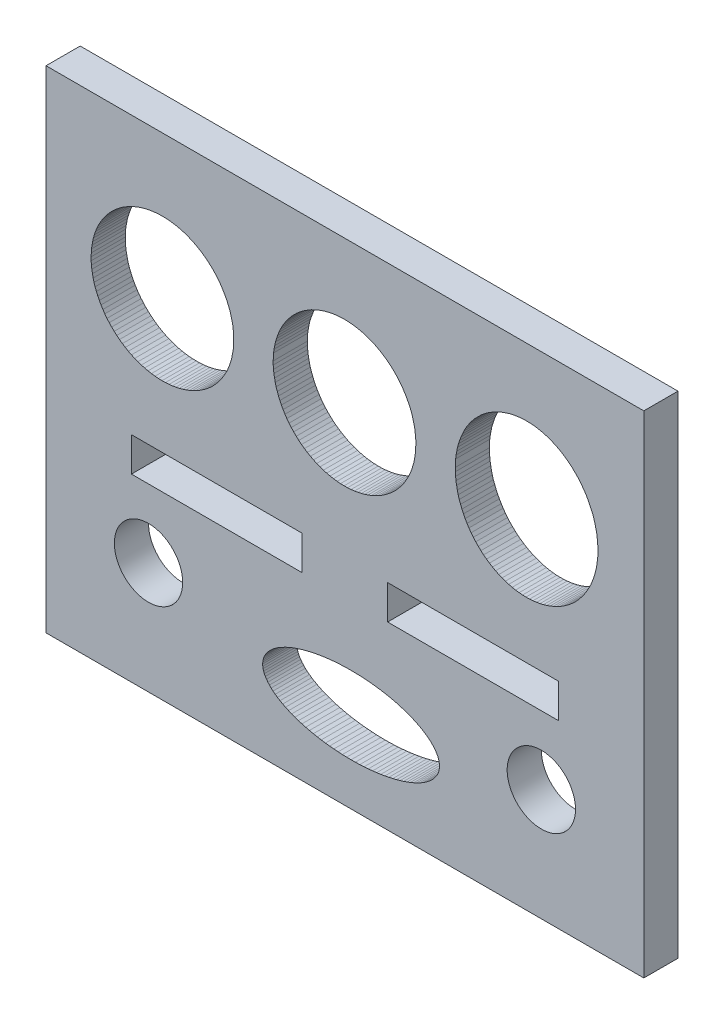
from build123d import *

# Parameters (mm, degrees)
MODEL_R         = 2
MODEL_W         = 10
MODEL_H         = 2
EXTRUDE_1_DEPTH = 2


with BuildPart() as part:
    # Model → 凸台-拉伸1 (new body)
    with BuildSketch(Plane.XY):
        Polygon((794.75972153, 604.491636772), (759.75972153, 604.491600122), (759.75972153, 633.249317629), (794.75972153, 633.249317629), align=None)
        with Locations((765.75972153, 611.043454307)):
            Circle(MODEL_R, mode=Mode.SUBTRACT)
        with Locations((788.75972153, 611.043454307)):
            Circle(MODEL_R, mode=Mode.SUBTRACT)
        with Locations((784.759690917, 616.042625672)):
            Rectangle(MODEL_W, MODEL_H, mode=Mode.SUBTRACT)
        with Locations((769.759690917, 616.042625672)):
            Rectangle(MODEL_W, MODEL_H, mode=Mode.SUBTRACT)
        Polygon((787.860385422, 620.357662882), (788.070385422, 620.360662882), (788.270385422, 620.375662882), (788.480385422, 620.401662882), (788.680385422, 620.437662882), (788.880385422, 620.483662882), (789.080385422, 620.541662882), (789.270385422, 620.608662882), (789.460385422, 620.686662882), (789.650385422, 620.773662882), (789.840385422, 620.871662882), (790.020385422, 620.978662882), (790.190385422, 621.094662882), (790.360385422, 621.219662882), (790.520385422, 621.353662882), (790.680385422, 621.495662882), (790.830385422, 621.646662882), (790.970385422, 621.804662882), (791.100385422, 621.969662882), (791.230385422, 622.141662882), (791.350385422, 622.320662882), (791.460385422, 622.505662882), (791.560385422, 622.695662882), (791.660385422, 622.891662882), (791.740385422, 623.091662882), (791.820385422, 623.295662882), (791.880385422, 623.503662882), (791.940385422, 623.714662882), (791.990385422, 623.928662882), (792.020385422, 624.144662882), (792.050385422, 624.362662882), (792.070385422, 624.581662882), (792.070385422, 624.801662882), (792.070385422, 625.020662882), (792.050385422, 625.239662882), (792.030385422, 625.457662882), (792.000385422, 625.674662882), (791.950385422, 625.888662882), (791.900385422, 626.100662882), (791.840385422, 626.309662882), (791.770385422, 626.515662882), (791.680385422, 626.716662882), (791.590385422, 626.913662882), (791.490385422, 627.105662882), (791.390385422, 627.291662882), (791.270385422, 627.471662882), (791.140385422, 627.645662882), (791.010385422, 627.813662882), (790.870385422, 627.973662882), (790.720385422, 628.125662882), (790.570385422, 628.270662882), (790.410385422, 628.406662882), (790.240385422, 628.534662882), (790.070385422, 628.652662882), (789.890385422, 628.762662882), (789.710385422, 628.862662882), (789.520385422, 628.952662882), (789.330385422, 629.032662882), (789.140385422, 629.103662882), (788.940385422, 629.163662882), (788.740385422, 629.212662882), (788.540385422, 629.251662882), (788.340385422, 629.280662882), (788.130385422, 629.297662882), (787.930385422, 629.304662882), (787.720385422, 629.300662882), (787.520385422, 629.285662882), (787.320385422, 629.260662882), (787.110385422, 629.224662882), (786.910385422, 629.177662882), (786.720385422, 629.120662882), (786.520385422, 629.053662882), (786.330385422, 628.975662882), (786.140385422, 628.887662882), (785.960385422, 628.790662882), (785.780385422, 628.683662882), (785.600385422, 628.567662882), (785.440385422, 628.441662882), (785.270385422, 628.307662882), (785.120385422, 628.165662882), (784.970385422, 628.015662882), (784.820385422, 627.857662882), (784.690385422, 627.691662882), (784.560385422, 627.519662882), (784.440385422, 627.340662882), (784.330385422, 627.156662882), (784.230385422, 626.965662882), (784.140385422, 626.770662882), (784.050385422, 626.570662882), (783.980385422, 626.365662882), (783.910385422, 626.157662882), (783.850385422, 625.946662882), (783.810385422, 625.732662882), (783.770385422, 625.516662882), (783.740385422, 625.298662882), (783.730385422, 625.079662882), (783.720385422, 624.860662882), (783.720385422, 624.640662882), (783.740385422, 624.421662882), (783.760385422, 624.203662882), (783.800385422, 623.987662882), (783.840385422, 623.772662882), (783.890385422, 623.560662882), (783.950385422, 623.351662882), (784.030385422, 623.146662882), (784.110385422, 622.944662882), (784.200385422, 622.748662882), (784.300385422, 622.556662882), (784.410385422, 622.370662882), (784.520385422, 622.189662882), (784.650385422, 622.015662882), (784.780385422, 621.848662882), (784.920385422, 621.688662882), (785.070385422, 621.535662882), (785.220385422, 621.391662882), (785.380385422, 621.255662882), (785.550385422, 621.127662882), (785.720385422, 621.008662882), (785.900385422, 620.899662882), (786.080385422, 620.799662882), (786.270385422, 620.708662882), (786.460385422, 620.628662882), (786.650385422, 620.558662882), (786.850385422, 620.498662882), (787.050385422, 620.448662882), (787.250385422, 620.409662882), (787.460385422, 620.381662882), (787.660385422, 620.363662882), align=None, mode=Mode.SUBTRACT)
        Polygon((777.210385422, 620.674662882), (777.410385422, 620.677662882), (777.620385422, 620.691662882), (777.820385422, 620.715662882), (778.020385422, 620.749662882), (778.220385422, 620.793662882), (778.420385422, 620.847662882), (778.610385422, 620.911662882), (778.810385422, 620.984662882), (778.990385422, 621.067662882), (779.180385422, 621.159662882), (779.360385422, 621.260662882), (779.530385422, 621.369662882), (779.700385422, 621.488662882), (779.860385422, 621.614662882), (780.020385422, 621.749662882), (780.170385422, 621.890662882), (780.310385422, 622.040662882), (780.440385422, 622.196662882), (780.570385422, 622.358662882), (780.690385422, 622.527662882), (780.800385422, 622.702662882), (780.900385422, 622.881662882), (781.000385422, 623.066662882), (781.080385422, 623.255662882), (781.160385422, 623.448662882), (781.220385422, 623.645662882), (781.280385422, 623.844662882), (781.330385422, 624.046662882), (781.360385422, 624.250662882), (781.390385422, 624.456662882), (781.400385422, 624.663662882), (781.410385422, 624.870662882), (781.410385422, 625.077662882), (781.390385422, 625.284662882), (781.370385422, 625.490662882), (781.340385422, 625.695662882), (781.290385422, 625.898662882), (781.240385422, 626.098662882), (781.180385422, 626.295662882), (781.110385422, 626.490662882), (781.020385422, 626.680662882), (780.930385422, 626.866662882), (780.830385422, 627.047662882), (780.720385422, 627.223662882), (780.610385422, 627.393662882), (780.480385422, 627.558662882), (780.350385422, 627.716662882), (780.210385422, 627.867662882), (780.060385422, 628.011662882), (779.910385422, 628.148662882), (779.750385422, 628.276662882), (779.580385422, 628.397662882), (779.410385422, 628.509662882), (779.230385422, 628.613662882), (779.050385422, 628.707662882), (778.860385422, 628.793662882), (778.670385422, 628.869662882), (778.480385422, 628.935662882), (778.280385422, 628.992662882), (778.080385422, 629.039662882), (777.880385422, 629.076662882), (777.680385422, 629.103662882), (777.470385422, 629.119662882), (777.270385422, 629.126662882), (777.060385422, 629.122662882), (776.860385422, 629.108662882), (776.650385422, 629.084662882), (776.450385422, 629.050662882), (776.250385422, 629.006662882), (776.050385422, 628.952662882), (775.860385422, 628.889662882), (775.670385422, 628.815662882), (775.480385422, 628.733662882), (775.290385422, 628.641662882), (775.120385422, 628.540662882), (774.940385422, 628.430662882), (774.770385422, 628.312662882), (774.610385422, 628.185662882), (774.450385422, 628.051662882), (774.310385422, 627.909662882), (774.160385422, 627.760662882), (774.030385422, 627.604662882), (773.900385422, 627.441662882), (773.780385422, 627.272662882), (773.670385422, 627.098662882), (773.570385422, 626.918662882), (773.470385422, 626.734662882), (773.390385422, 626.544662882), (773.320385422, 626.351662882), (773.250385422, 626.155662882), (773.190385422, 625.955662882), (773.150385422, 625.753662882), (773.110385422, 625.549662882), (773.080385422, 625.344662882), (773.070385422, 625.137662882), (773.060385422, 624.930662882), (773.060385422, 624.722662882), (773.080385422, 624.515662882), (773.100385422, 624.309662882), (773.140385422, 624.104662882), (773.180385422, 623.902662882), (773.230385422, 623.701662882), (773.300385422, 623.504662882), (773.370385422, 623.310662882), (773.450385422, 623.120662882), (773.540385422, 622.934662882), (773.640385422, 622.753662882), (773.750385422, 622.577662882), (773.860385422, 622.406662882), (773.990385422, 622.242662882), (774.120385422, 622.084662882), (774.260385422, 621.933662882), (774.410385422, 621.788662882), (774.560385422, 621.652662882), (774.720385422, 621.523662882), (774.890385422, 621.402662882), (775.060385422, 621.290662882), (775.240385422, 621.187662882), (775.420385422, 621.092662882), (775.610385422, 621.007662882), (775.800385422, 620.931662882), (776.000385422, 620.864662882), (776.190385422, 620.808662882), (776.390385422, 620.761662882), (776.590385422, 620.724662882), (776.800385422, 620.697662882), (777.000385422, 620.680662882), align=None, mode=Mode.SUBTRACT)
        Polygon((766.550385422, 620.676662882), (766.750385422, 620.679662882), (766.960385422, 620.693662882), (767.160385422, 620.717662882), (767.360385422, 620.750662882), (767.560385422, 620.794662882), (767.760385422, 620.847662882), (767.950385422, 620.910662882), (768.150385422, 620.982662882), (768.330385422, 621.064662882), (768.520385422, 621.155662882), (768.700385422, 621.255662882), (768.870385422, 621.363662882), (769.040385422, 621.480662882), (769.200385422, 621.605662882), (769.360385422, 621.737662882), (769.510385422, 621.878662882), (769.650385422, 622.025662882), (769.780385422, 622.179662882), (769.910385422, 622.340662882), (770.030385422, 622.507662882), (770.140385422, 622.679662882), (770.240385422, 622.857662882), (770.340385422, 623.039662882), (770.420385422, 623.226662882), (770.500385422, 623.416662882), (770.560385422, 623.610662882), (770.620385422, 623.808662882), (770.660385422, 624.007662882), (770.700385422, 624.209662882), (770.730385422, 624.412662882), (770.740385422, 624.616662882), (770.750385422, 624.821662882), (770.750385422, 625.026662882), (770.730385422, 625.231662882), (770.710385422, 625.434662882), (770.680385422, 625.636662882), (770.630385422, 625.837662882), (770.580385422, 626.034662882), (770.520385422, 626.229662882), (770.440385422, 626.421662882), (770.360385422, 626.609662882), (770.270385422, 626.793662882), (770.170385422, 626.972662882), (770.060385422, 627.146662882), (769.950385422, 627.314662882), (769.820385422, 627.477662882), (769.690385422, 627.633662882), (769.550385422, 627.782662882), (769.400385422, 627.924662882), (769.250385422, 628.059662882), (769.090385422, 628.187662882), (768.920385422, 628.306662882), (768.750385422, 628.417662882), (768.570385422, 628.519662882), (768.390385422, 628.612662882), (768.200385422, 628.697662882), (768.010385422, 628.772662882), (767.820385422, 628.838662882), (767.620385422, 628.894662882), (767.420385422, 628.940662882), (767.220385422, 628.976662882), (767.010385422, 629.003662882), (766.810385422, 629.019662882), (766.610385422, 629.026662882), (766.400385422, 629.022662882), (766.200385422, 629.009662882), (765.990385422, 628.985662882), (765.790385422, 628.952662882), (765.590385422, 628.908662882), (765.390385422, 628.855662882), (765.200385422, 628.792662882), (765.010385422, 628.720662882), (764.820385422, 628.638662882), (764.630385422, 628.547662882), (764.460385422, 628.447662882), (764.280385422, 628.339662882), (764.110385422, 628.222662882), (763.950385422, 628.097662882), (763.790385422, 627.964662882), (763.640385422, 627.824662882), (763.500385422, 627.677662882), (763.370385422, 627.523662882), (763.240385422, 627.362662882), (763.120385422, 627.195662882), (763.010385422, 627.023662882), (762.910385422, 626.845662882), (762.810385422, 626.663662882), (762.730385422, 626.476662882), (762.650385422, 626.285662882), (762.590385422, 626.091662882), (762.530385422, 625.894662882), (762.490385422, 625.695662882), (762.450385422, 625.493662882), (762.420385422, 625.290662882), (762.410385422, 625.085662882), (762.400385422, 624.881662882), (762.400385422, 624.676662882), (762.420385422, 624.471662882), (762.440385422, 624.268662882), (762.480385422, 624.066662882), (762.520385422, 623.865662882), (762.570385422, 623.667662882), (762.630385422, 623.472662882), (762.710385422, 623.281662882), (762.790385422, 623.093662882), (762.880385422, 622.909662882), (762.980385422, 622.730662882), (763.090385422, 622.556662882), (763.200385422, 622.388662882), (763.330385422, 622.225662882), (763.460385422, 622.069662882), (763.600385422, 621.920662882), (763.750385422, 621.777662882), (763.900385422, 621.642662882), (764.060385422, 621.515662882), (764.230385422, 621.396662882), (764.400385422, 621.285662882), (764.580385422, 621.183662882), (764.760385422, 621.089662882), (764.950385422, 621.005662882), (765.140385422, 620.930662882), (765.340385422, 620.864662882), (765.530385422, 620.808662882), (765.730385422, 620.762662882), (765.930385422, 620.725662882), (766.140385422, 620.699662882), (766.340385422, 620.682662882), align=None, mode=Mode.SUBTRACT)
        Polygon((782.790385422, 609.253662882), (782.790385422, 609.364662882), (782.770385422, 609.475662882), (782.740385422, 609.585662882), (782.700385422, 609.695662882), (782.640385422, 609.803662882), (782.570385422, 609.911662882), (782.490385422, 610.016662882), (782.400385422, 610.120662882), (782.300385422, 610.222662882), (782.180385422, 610.321662882), (782.060385422, 610.418662882), (781.920385422, 610.512662882), (781.780385422, 610.603662882), (781.620385422, 610.690662882), (781.450385422, 610.775662882), (781.280385422, 610.855662882), (781.090385422, 610.932662882), (780.900385422, 611.005662882), (780.700385422, 611.073662882), (780.490385422, 611.137662882), (780.280385422, 611.197662882), (780.060385422, 611.251662882), (779.830385422, 611.301662882), (779.600385422, 611.347662882), (779.360385422, 611.387662882), (779.120385422, 611.421662882), (778.880385422, 611.451662882), (778.630385422, 611.476662882), (778.380385422, 611.495662882), (778.130385422, 611.508662882), (777.870385422, 611.516662882), (777.620385422, 611.519662882), (777.360385422, 611.516662882), (777.110385422, 611.508662882), (776.860385422, 611.495662882), (776.610385422, 611.476662882), (776.360385422, 611.451662882), (776.120385422, 611.421662882), (775.870385422, 611.387662882), (775.640385422, 611.347662882), (775.410385422, 611.301662882), (775.180385422, 611.251662882), (774.960385422, 611.197662882), (774.740385422, 611.137662882), (774.540385422, 611.073662882), (774.330385422, 611.005662882), (774.140385422, 610.932662882), (773.960385422, 610.855662882), (773.780385422, 610.775662882), (773.620385422, 610.690662882), (773.460385422, 610.603662882), (773.310385422, 610.512662882), (773.180385422, 610.418662882), (773.050385422, 610.321662882), (772.940385422, 610.222662882), (772.840385422, 610.120662882), (772.750385422, 610.016662882), (772.670385422, 609.911662882), (772.600385422, 609.803662882), (772.540385422, 609.695662882), (772.500385422, 609.585662882), (772.470385422, 609.475662882), (772.450385422, 609.364662882), (772.440385422, 609.253662882), (772.450385422, 609.141662882), (772.470385422, 609.031662882), (772.500385422, 608.920662882), (772.540385422, 608.811662882), (772.600385422, 608.702662882), (772.670385422, 608.595662882), (772.750385422, 608.489662882), (772.840385422, 608.385662882), (772.940385422, 608.284662882), (773.050385422, 608.184662882), (773.180385422, 608.088662882), (773.310385422, 607.994662882), (773.460385422, 607.903662882), (773.620385422, 607.815662882), (773.780385422, 607.731662882), (773.960385422, 607.650662882), (774.140385422, 607.573662882), (774.330385422, 607.501662882), (774.540385422, 607.432662882), (774.740385422, 607.368662882), (774.960385422, 607.309662882), (775.180385422, 607.254662882), (775.410385422, 607.204662882), (775.640385422, 607.159662882), (775.870385422, 607.119662882), (776.120385422, 607.084662882), (776.360385422, 607.054662882), (776.610385422, 607.030662882), (776.860385422, 607.011662882), (777.110385422, 606.997662882), (777.360385422, 606.989662882), (777.620385422, 606.986662882), (777.870385422, 606.989662882), (778.130385422, 606.997662882), (778.380385422, 607.011662882), (778.630385422, 607.030662882), (778.880385422, 607.054662882), (779.120385422, 607.084662882), (779.360385422, 607.119662882), (779.600385422, 607.159662882), (779.830385422, 607.204662882), (780.060385422, 607.254662882), (780.280385422, 607.309662882), (780.490385422, 607.368662882), (780.700385422, 607.432662882), (780.900385422, 607.501662882), (781.090385422, 607.573662882), (781.280385422, 607.650662882), (781.450385422, 607.731662882), (781.620385422, 607.815662882), (781.780385422, 607.903662882), (781.920385422, 607.994662882), (782.060385422, 608.088662882), (782.180385422, 608.184662882), (782.300385422, 608.284662882), (782.400385422, 608.385662882), (782.490385422, 608.489662882), (782.570385422, 608.595662882), (782.640385422, 608.702662882), (782.700385422, 608.811662882), (782.740385422, 608.920662882), (782.770385422, 609.031662882), (782.790385422, 609.141662882), align=None, mode=Mode.SUBTRACT)
    extrude(amount=EXTRUDE_1_DEPTH)


solid = part.part
